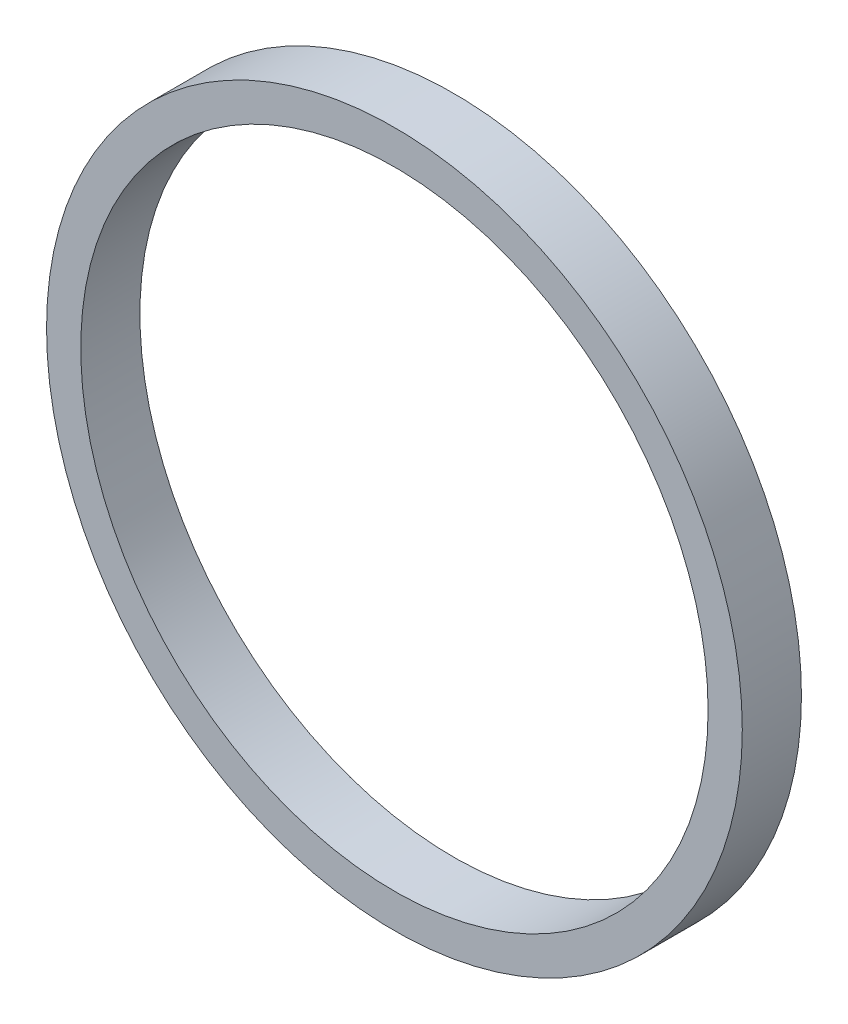
from build123d import *

# Parameters (mm, degrees)
SKETCH1_W = 4.7244
SKETCH1_H = 2.73125


with BuildPart() as part:
    # Sketch1 → Revolve1 (revolve)
    with BuildSketch(Plane(origin=(0, 0, 0), x_dir=(0, 0, -1), z_dir=(1, 0, 0)), mode=Mode.PRIVATE) as revolve1_sk:
        with Locations((0, 26.415625)):
            Rectangle(SKETCH1_W, SKETCH1_H)
    revolve(revolve1_sk.sketch.rotate(Axis((0, 0, 35.62703085), (0, 0, -1)), 90), axis=Axis((0, 0, 35.62703085), (0, 0, -1)))


solid = part.part
